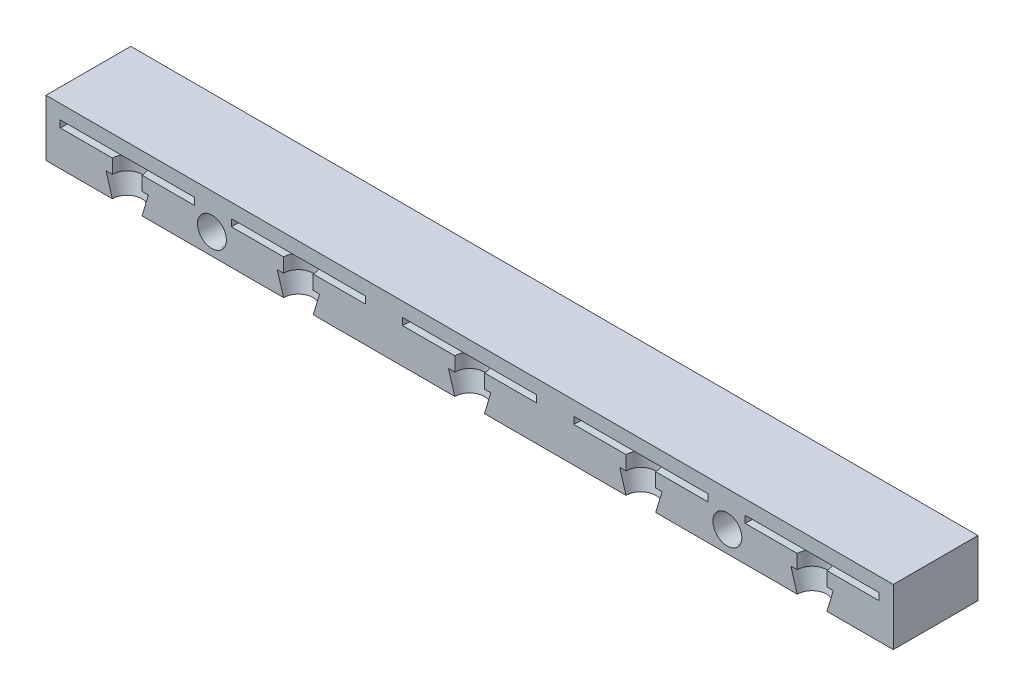
from build123d import *

# Parameters (mm, degrees)
SKETCH2_W                    = 120
SKETCH2_H                    = 8
BOSS_EXTRUDE1_DEPTH          = 12
LPATTERN1_COUNT              = 5
LPATTERN1_PITCH              = 24.25
SKETCH4_R                    = 2.05
CUT_EXTRUDE1_DEPTH           = 5
CUT_EXTRUDE1_DRAFT           = -1
CUT_EXTRUDE1_PROFILE_2_DEPTH = 5
CUT_EXTRUDE1_PROFILE_2_DRAFT = -1


with BuildPart() as part:
    # Sketch2 → Boss-Extrude1 (new body)
    with BuildSketch(Plane.XY):
        with Locations((60, 4)):
            Rectangle(SKETCH2_W, SKETCH2_H)
    extrude(amount=-BOSS_EXTRUDE1_DEPTH)

    # Sketch3 → Cut-Revolve1 (revolve, cut)
    with BuildSketch(Plane.XY):
        Polygon((8.5, 3), (9.4, 3), (9.4, 5), (2, 5), (2, 6), (11.5, 6), (11.5, 0), (9.4, 0), align=None)
    cut_revolve1 = revolve(axis=Axis((11.5, 6, 0), (0, -1, 0)), mode=Mode.SUBTRACT)

    # LPattern1: Cut-Revolve1 ×5
    with Locations(*[(i * LPATTERN1_PITCH, 0, 0) for i in range(1, LPATTERN1_COUNT)]):
        add(cut_revolve1, mode=Mode.SUBTRACT)


with BuildPart() as cut_extrude1_tool:
    # Sketch4 → Cut-Extrude1 (with draft: the straight prism first)
    with BuildSketch(Plane.XY):
        with Locations((23.5, 3)):
            Circle(SKETCH4_R)
    extrude(amount=-CUT_EXTRUDE1_DEPTH)
    # Cut-Extrude1: the draft: its side faces are tilted about the plane it starts from
    cut_extrude1_sides = [cut_extrude1_tool.faces().sort_by_distance(p)[0] for p in [
        (21.45, 3, -2.5),
    ]]
    draft(cut_extrude1_sides, Plane.XY, CUT_EXTRUDE1_DRAFT)


with BuildPart() as part_1:
    add(part.part)

    # Cut-Extrude1: cut by cut_extrude1_tool
    add(cut_extrude1_tool.part, mode=Mode.SUBTRACT)


with BuildPart() as cut_extrude1_profile_2_tool:
    # Sketch4 → Cut-Extrude1 profile 2 (with draft: the straight prism first)
    with BuildSketch(Plane.XY):
        with Locations((96.5, 3)):
            Circle(SKETCH4_R)
    extrude(amount=-CUT_EXTRUDE1_PROFILE_2_DEPTH)
    # Cut-Extrude1 profile 2: the draft: its side faces are tilted about the plane it starts from
    cut_extrude1_profile_2_sides = [cut_extrude1_profile_2_tool.faces().sort_by_distance(p)[0] for p in [
        (94.45, 3, -2.5),
    ]]
    draft(cut_extrude1_profile_2_sides, Plane.XY, CUT_EXTRUDE1_PROFILE_2_DRAFT)


with BuildPart() as part_2:
    add(part_1.part)

    # Cut-Extrude1 profile 2: cut by cut_extrude1_profile_2_tool
    add(cut_extrude1_profile_2_tool.part, mode=Mode.SUBTRACT)


solid = part_2.part
